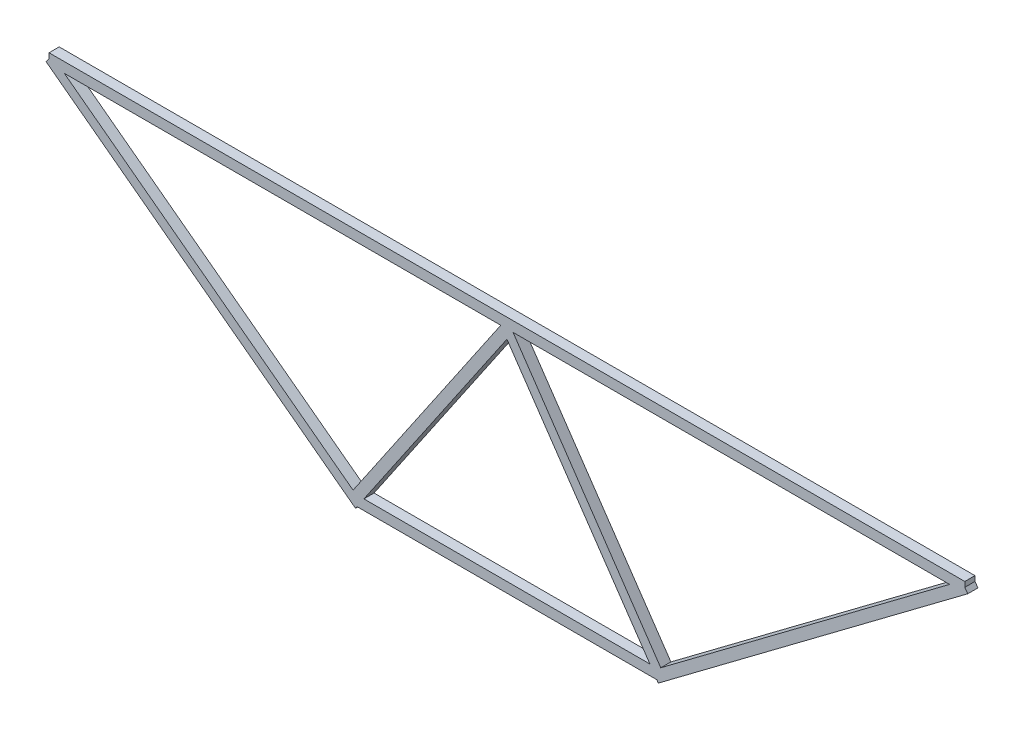
from build123d import *

# Parameters (mm, degrees)
SKETCH1_W           = 1200
SKETCH1_H           = 13.3
EXTRUDE_THIN1_DEPTH = 6.65
SKETCH2_W           = 400
SKETCH2_H           = 13.3
EXTRUDE_THIN2_DEPTH = 6.65
EXTRUDE_THIN3_DEPTH = 6.65


with BuildPart() as part:
    # Sketch1 → Extrude-Thin1 (new, symmetric)
    with BuildSketch(Plane.XY):
        with Locations((600, -6.65)):
            Rectangle(SKETCH1_W, SKETCH1_H)
    extrude(amount=EXTRUDE_THIN1_DEPTH, both=True)



with BuildPart() as body_2:
    # Sketch2 → Extrude-Thin2 (new, symmetric)
    with BuildSketch(Plane.XY):
        with Locations((600, -306.65)):
            Rectangle(SKETCH2_W, SKETCH2_H)
    extrude(amount=EXTRUDE_THIN2_DEPTH, both=True)


with BuildPart() as part_1:
    add(part.part)

    add(body_2.part)  # Extrude-Thin3 merges body 2
    # Sketch3 → Extrude-Thin3 (add, symmetric)
    with BuildSketch(Plane.XY):
        Polygon((1196.01, -1.33), (801.575558109, -297.155831418), (600, -1.494881561), (398.424441891, -297.155831418), (3.99, -1.33), (-3.99, -11.97), (401.575558109, -316.144168582), (600, -25.105118439), (798.424441891, -316.144168582), (1203.99, -11.97), align=None)
    extrude(amount=EXTRUDE_THIN3_DEPTH, both=True)


solid = part_1.part
